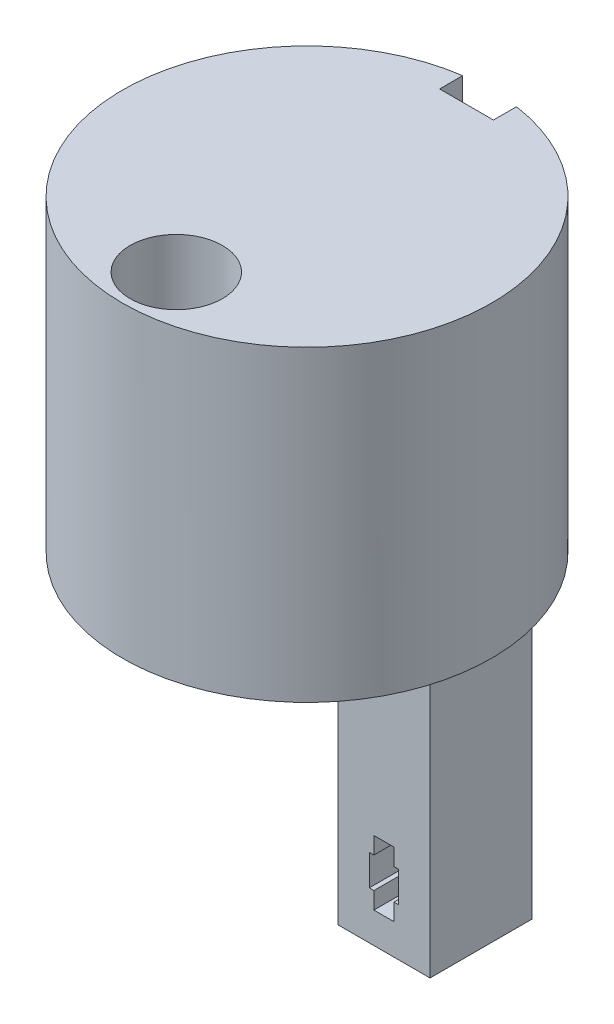
from build123d import *
from build123d.topology import SkipClean

# Parameters (mm, degrees)
SKETCH_1_R               = 12
EXTRUDE_1_DEPTH          = 20
SKETCH_2_R               = 1.975
CUT_EXTRUDE_1_DEPTH      = 15
SKETCH_3_R               = 3
CUT_EXTRUDE_2_DEPTH      = 27.229754097
EXTRUDE_START            = 25
SKETCH_4_W               = 6
SKETCH_4_H               = 6.618950039
EXTRUDE_2_DEPTH          = 25
CUT_EXTRUDE_START        = -37
SKETCH_5_W               = 3.5
SKETCH_5_H               = 1.5
CUT_EXTRUDE_3_DEPTH      = 37
CUT_EXTRUDE_4_DEPTH      = 33.526911935
CUT_EXTRUDE_4_DEPTH_BACK = 5
SKETCH_6_W               = 1.3
SKETCH_6_H               = 4.2
SKETCH_7_W               = 1.3
SKETCH_7_H               = 5.2
CUT_EXTRUDE_5_DEPTH      = 36.397740041
SKETCH_8_W               = 1.9
SKETCH_8_H               = 2
CUT_EXTRUDE_6_DEPTH      = 33.526911935
CHAMFER_1_SIZE           = 0.5
SKETCH_9_W               = 1
SKETCH_9_H               = 0.8
CUT_EXTRUDE_7_DEPTH      = 15
PATTERN_CIRCULAR_1_COUNT = 8
MIRROR_1_COPY_1_SKETCH_W = 1
MIRROR_1_COPY_1_SKETCH_H = 0.8
MIRROR_1_COPY_1_DEPTH    = 15
MIRROR_1_COPY_2_SKETCH_W = 1
MIRROR_1_COPY_2_SKETCH_H = 0.8
MIRROR_1_COPY_2_DEPTH    = 15
MIRROR_1_COPY_3_SKETCH_W = 1
MIRROR_1_COPY_3_SKETCH_H = 0.8
MIRROR_1_COPY_3_DEPTH    = 15
MIRROR_1_COPY_4_SKETCH_W = 1
MIRROR_1_COPY_4_SKETCH_H = 0.8
MIRROR_1_COPY_4_DEPTH    = 15
MIRROR_1_COPY_5_SKETCH_W = 1
MIRROR_1_COPY_5_SKETCH_H = 0.8
MIRROR_1_COPY_5_DEPTH    = 15
MIRROR_1_COPY_6_SKETCH_W = 1
MIRROR_1_COPY_6_SKETCH_H = 0.8
MIRROR_1_COPY_6_DEPTH    = 15
MIRROR_1_COPY_7_SKETCH_W = 1
MIRROR_1_COPY_7_SKETCH_H = 0.8
MIRROR_1_COPY_7_DEPTH    = 15


with BuildPart() as part:
    # 草图1 → 凸台-拉伸1 (new body)
    with BuildSketch(Plane(origin=(0, 0, 0), x_dir=(1, 0, 0), z_dir=(0, 1, 0))):
        with Locations(Location((0, 0, 0), (0, 0, 270))):
            Circle(SKETCH_1_R)
    extrude(amount=EXTRUDE_1_DEPTH)

    # 草图2 → 切除-拉伸1 (cut)
    with BuildSketch(Plane.XZ):
        with Locations(Location((7.5, 0, 0), (0, 0, 270))):
            Circle(SKETCH_2_R)
        with Locations(Location((-7.5, 0, 0), (0, 0, 90))):
            Circle(SKETCH_2_R)
    extrude(amount=-CUT_EXTRUDE_1_DEPTH, mode=Mode.SUBTRACT)

    # 草图3 → 切除-拉伸2 (cut, through all)
    with BuildSketch(Plane.XZ):
        with Locations(Location((0, 8.5, 0), (0, 0, 270))):
            Circle(SKETCH_3_R)
    extrude(amount=-CUT_EXTRUDE_2_DEPTH, mode=Mode.SUBTRACT)

    # 草图4 → 凸台-拉伸2 (add)
    with SkipClean():  # the faces are left unmerged after this step: merging them gives an invalid solid
        with BuildSketch(Plane.XZ.offset(EXTRUDE_START)):
            with Locations((0, -8.30947502)):
                Rectangle(SKETCH_4_W, SKETCH_4_H)
            with BuildLine():
                Line((3, -11.618950039), (-3, -11.618950039))
                ThreePointArc((-3, -11.618950039), (0, -12), (3, -11.618950039))
            make_face()
        extrude(amount=-EXTRUDE_2_DEPTH)

    # 草图5 → 切除-拉伸3 (cut)
    with SkipClean():  # the faces are left unmerged after this step: merging them gives an invalid solid
        with BuildSketch(Plane(origin=(0, 20, 0), x_dir=(1, 0, 0), z_dir=(0, 1, 0)).offset(CUT_EXTRUDE_START)):
            with Locations((0, 11.121710071)):
                Rectangle(SKETCH_5_W, SKETCH_5_H)
            with BuildLine():
                Line((-1.75, 11.871710071), (1.75, 11.871710071))
                ThreePointArc((1.75, 11.871710071), (0, 12), (-1.75, 11.871710071))
            make_face()
        extrude(amount=CUT_EXTRUDE_3_DEPTH, mode=Mode.SUBTRACT)

    # 草图6 → 切除-拉伸4 (cut, two sides: drawn at the far end of the back side and taken through both)
    with SkipClean():  # the faces are left unmerged after this step: merging them gives an invalid solid
        with BuildSketch(Plane.XY.offset(-5).offset(-CUT_EXTRUDE_4_DEPTH_BACK)):
            with Locations((0, -20.9)):
                Rectangle(SKETCH_6_W, SKETCH_6_H)
        extrude(amount=CUT_EXTRUDE_4_DEPTH + CUT_EXTRUDE_4_DEPTH_BACK, mode=Mode.SUBTRACT)

    # 草图7 → 切除-拉伸5 (cut, through all)
    with SkipClean():  # the faces are left unmerged after this step: merging them gives an invalid solid
        with BuildSketch(Plane.XY.offset(-10)):
            with Locations((0, -20.9)):
                Rectangle(SKETCH_7_W, SKETCH_7_H)
        extrude(amount=-CUT_EXTRUDE_5_DEPTH, mode=Mode.SUBTRACT)

    # 草图8 → 切除-拉伸6 (cut, through all)
    with SkipClean():  # the faces are left unmerged after this step: merging them gives an invalid solid
        with BuildSketch(Plane.XY.offset(-5)):
            with Locations((0, -20.9)):
                Rectangle(SKETCH_8_W, SKETCH_8_H)
        extrude(amount=-CUT_EXTRUDE_6_DEPTH, mode=Mode.SUBTRACT)

    # 倒角1
    chamfer_1_edges = [part.edges().sort_by_distance(p)[0] for p in [
        (7.5, 0, 1.975),
        (-7.5, 0, -1.975),
    ]]
    chamfer(chamfer_1_edges, length=CHAMFER_1_SIZE)

    # 草图9 → 切除-拉伸7 (cut)
    with SkipClean():  # the faces are left unmerged after this step: merging them gives an invalid solid
        with BuildSketch(Plane.XZ):
            with Locations((5.065930456, 0)):
                Rectangle(SKETCH_9_W, SKETCH_9_H)
        cut_extrude_7 = extrude(amount=-CUT_EXTRUDE_7_DEPTH, mode=Mode.SUBTRACT)

    # 阵列(圆周)1: 切除-拉伸7 ×8 about axis
    with SkipClean():  # the faces are left unmerged after this step: merging them gives an invalid solid
        pattern_circular_1_axis = Axis((7.5, 0, 0), (0, 1, 0))
        for i in range(1, PATTERN_CIRCULAR_1_COUNT):
            add(cut_extrude_7.rotate(pattern_circular_1_axis, i * 360 / PATTERN_CIRCULAR_1_COUNT), mode=Mode.SUBTRACT)

    # 镜向1: 切除-拉伸7 across plane
    with SkipClean():  # the faces are left unmerged after this step: merging them gives an invalid solid
        add(cut_extrude_7.mirror(Plane(origin=(0, 0, 0), x_dir=(0, 0, 1), z_dir=(1, 0, 0))), mode=Mode.SUBTRACT)

    # 镜向1 copy 1 sketch → 镜向1 copy 1 (cut)
    with SkipClean():  # the faces are left unmerged after this step: merging them gives an invalid solid
        with BuildSketch(Plane(origin=(-2.196699141, 0, 5.303300859), x_dir=(-0.7071067811865476, 0, -0.7071067811865475), z_dir=(0, -1, 0))):
            with Locations((5.065930456, 0)):
                Rectangle(MIRROR_1_COPY_1_SKETCH_W, MIRROR_1_COPY_1_SKETCH_H)
        extrude(amount=-MIRROR_1_COPY_1_DEPTH, mode=Mode.SUBTRACT)

    # 镜向1 copy 2 sketch → 镜向1 copy 2 (cut)
    with SkipClean():  # the faces are left unmerged after this step: merging them gives an invalid solid
        with BuildSketch(Plane(origin=(-7.5, 0, 7.5), x_dir=(0, 0, -1), z_dir=(0, -1, 0))):
            with Locations((5.065930456, 0)):
                Rectangle(MIRROR_1_COPY_2_SKETCH_W, MIRROR_1_COPY_2_SKETCH_H)
        extrude(amount=-MIRROR_1_COPY_2_DEPTH, mode=Mode.SUBTRACT)

    # 镜向1 copy 3 sketch → 镜向1 copy 3 (cut)
    with SkipClean():  # the faces are left unmerged after this step: merging them gives an invalid solid
        with BuildSketch(Plane(origin=(-12.803300859, 0, 5.303300859), x_dir=(0.7071067811865475, 0, -0.7071067811865476), z_dir=(0, -1, 0))):
            with Locations((5.065930456, 0)):
                Rectangle(MIRROR_1_COPY_3_SKETCH_W, MIRROR_1_COPY_3_SKETCH_H)
        extrude(amount=-MIRROR_1_COPY_3_DEPTH, mode=Mode.SUBTRACT)

    # 镜向1 copy 4 sketch → 镜向1 copy 4 (cut)
    with SkipClean():  # the faces are left unmerged after this step: merging them gives an invalid solid
        with BuildSketch(Plane(origin=(-15, 0, 0), x_dir=(1, 0, 0), z_dir=(0, -1, 0))):
            with Locations((5.065930456, 0)):
                Rectangle(MIRROR_1_COPY_4_SKETCH_W, MIRROR_1_COPY_4_SKETCH_H)
        extrude(amount=-MIRROR_1_COPY_4_DEPTH, mode=Mode.SUBTRACT)

    # 镜向1 copy 5 sketch → 镜向1 copy 5 (cut)
    with SkipClean():  # the faces are left unmerged after this step: merging them gives an invalid solid
        with BuildSketch(Plane(origin=(-12.803300859, 0, -5.303300859), x_dir=(0.7071067811865477, 0, 0.7071067811865475), z_dir=(0, -1, 0))):
            with Locations((5.065930456, 0)):
                Rectangle(MIRROR_1_COPY_5_SKETCH_W, MIRROR_1_COPY_5_SKETCH_H)
        extrude(amount=-MIRROR_1_COPY_5_DEPTH, mode=Mode.SUBTRACT)

    # 镜向1 copy 6 sketch → 镜向1 copy 6 (cut)
    with SkipClean():  # the faces are left unmerged after this step: merging them gives an invalid solid
        with BuildSketch(Plane(origin=(-7.5, 0, -7.5), x_dir=(0, 0, 1), z_dir=(0, -1, 0))):
            with Locations((5.065930456, 0)):
                Rectangle(MIRROR_1_COPY_6_SKETCH_W, MIRROR_1_COPY_6_SKETCH_H)
        extrude(amount=-MIRROR_1_COPY_6_DEPTH, mode=Mode.SUBTRACT)

    # 镜向1 copy 7 sketch → 镜向1 copy 7 (cut)
    with SkipClean():  # the faces are left unmerged after this step: merging them gives an invalid solid
        with BuildSketch(Plane(origin=(-2.196699141, 0, -5.303300859), x_dir=(-0.7071067811865474, 0, 0.7071067811865477), z_dir=(0, -1, 0))):
            with Locations((5.065930456, 0)):
                Rectangle(MIRROR_1_COPY_7_SKETCH_W, MIRROR_1_COPY_7_SKETCH_H)
        extrude(amount=-MIRROR_1_COPY_7_DEPTH, mode=Mode.SUBTRACT)


solid = part.part
